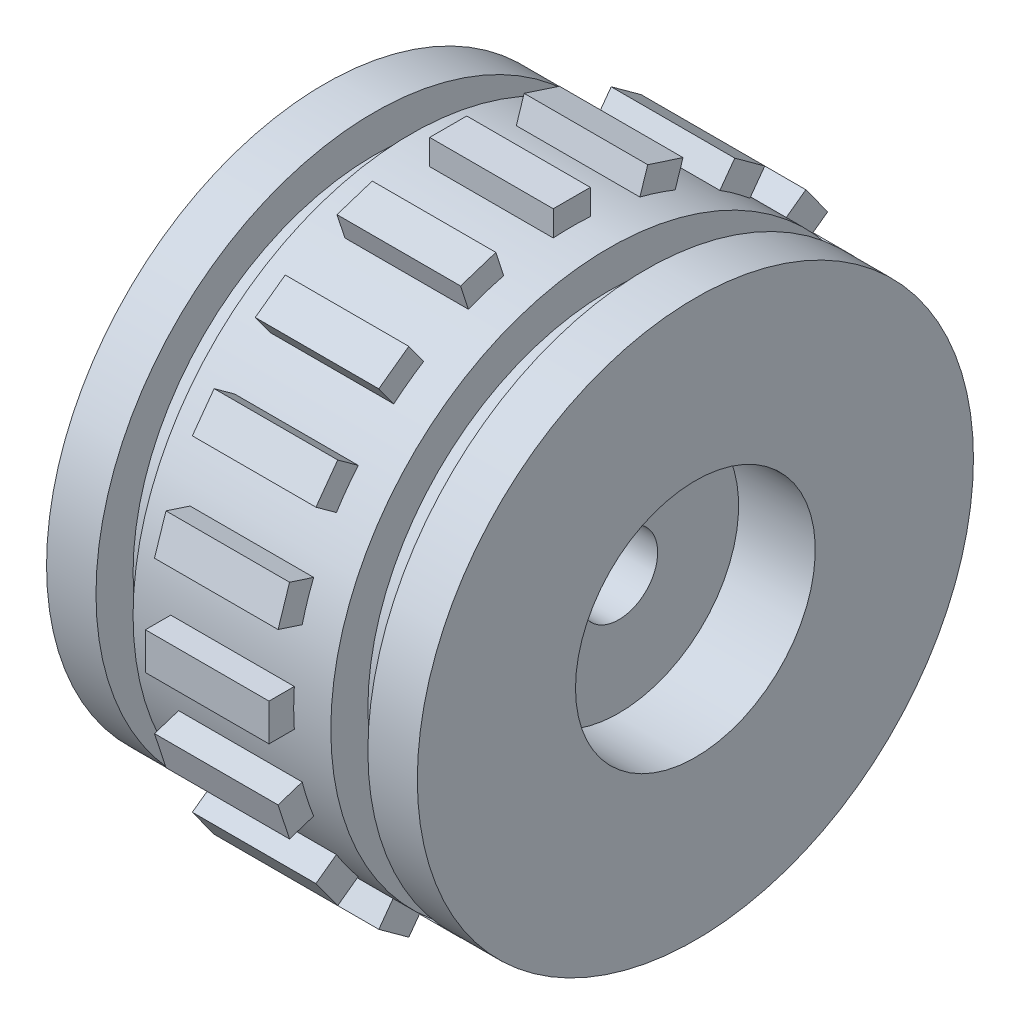
from build123d import *

# Parameters (mm, degrees)
CHAMFER_2_SIZE           = 2
SKETCH_6_W               = 3
SKETCH_6_H               = 4
SKETCH_7_W               = 10
SKETCH_7_H               = 3.436723268
EXTRUDE_1_DEPTH          = 1.5
PATTERN_CIRCULAR_1_COUNT = 20


with BuildPart() as part:
    # Эскиз4 → Повернуть1 (revolve)
    with BuildSketch(Plane.XY, mode=Mode.PRIVATE) as revolve_1_sk:
        Polygon((0, 22.5), (-30, 22.5), (-30, 18.5), (-19, 18.5), (-19, 5.1), (-13, 5.1), (-13, 3.15), (-6.2, 3.15), (-6.2, 9.7), (0, 9.7), align=None)
    revolve(revolve_1_sk.sketch.rotate(Axis((-30, 0, 0), (1, 0, 0)), 90), axis=Axis((-30, 0, 0), (1, 0, 0)))

    # Фаска2
    chamfer_2_edges = [part.edges().sort_by_distance(p)[0] for p in [
        (-19, 0, -18.5),
        (-30, 0, -18.5),
    ]]
    chamfer(chamfer_2_edges, length=CHAMFER_2_SIZE)

    # Эскиз6 → Вырез-Повернуть2 (revolve, cut)
    with BuildSketch(Plane.XY, mode=Mode.PRIVATE) as cut_revolve_2_sk:
        with Locations((-24.5, 21.5)):
            Rectangle(SKETCH_6_W, SKETCH_6_H)
        with Locations((-5.5, 21.5)):
            Rectangle(SKETCH_6_W, SKETCH_6_H)
    revolve(cut_revolve_2_sk.sketch.rotate(Axis((-30, 0, 0), (1, 0, 0)), 90), axis=Axis((-30, 0, 0), (1, 0, 0)), mode=Mode.SUBTRACT)

    # Эскиз7 → Бобышка-Вытянуть1 (add, symmetric)
    with BuildSketch(Plane.XY):
        with Locations((-15, 22.781638366)):
            Rectangle(SKETCH_7_W, SKETCH_7_H)
    extrude_1 = extrude(amount=EXTRUDE_1_DEPTH, both=True)

    # Круговой массив1: Бобышка-Вытянуть1 ×20 about axis
    pattern_circular_1_axis = Axis((0, 0, 0), (1, 0, 0))
    for i in range(1, PATTERN_CIRCULAR_1_COUNT):
        add(extrude_1.rotate(pattern_circular_1_axis, i * 360 / PATTERN_CIRCULAR_1_COUNT))


solid = part.part
